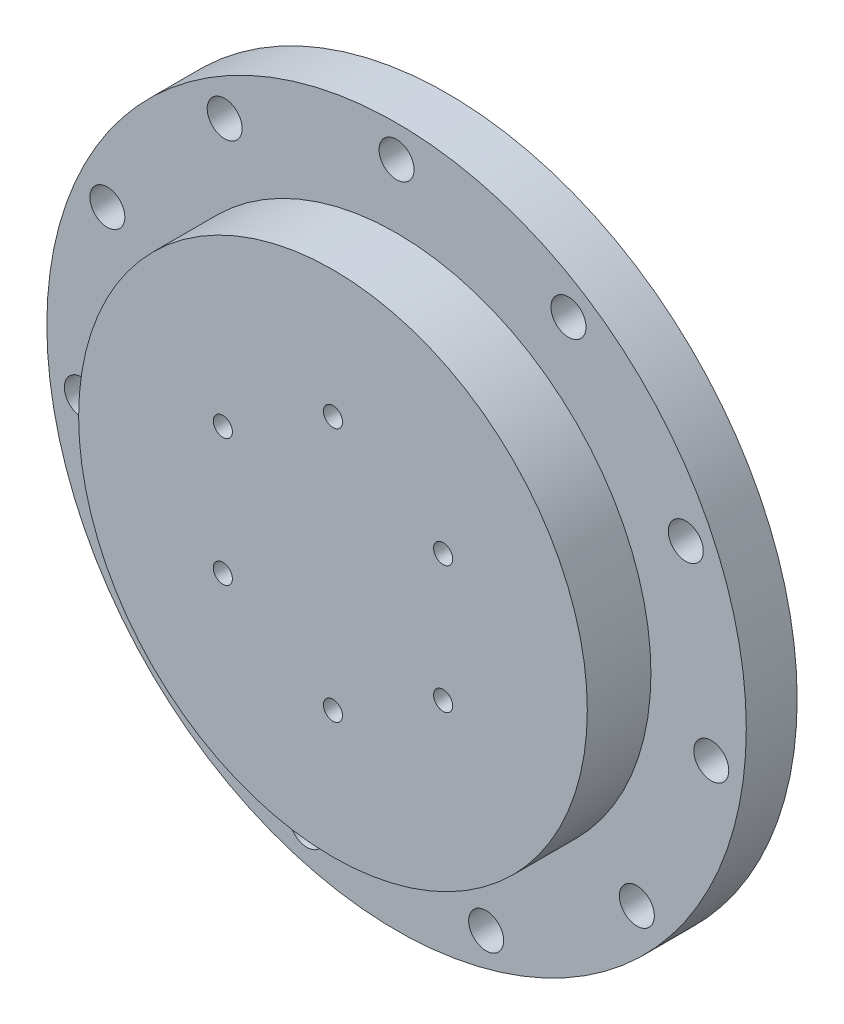
from build123d import *

# Parameters (mm, degrees)
SKETCH1_R           = 55
SKETCH1_R_2         = 1.5
BOSS_EXTRUDE1_DEPTH = 15
CUT_EXTRUDE2_START  = -10
SKETCH3_R           = 55
SKETCH3_R_2         = 17.5
CUT_EXTRUDE2_DEPTH  = 10
SKETCH7_R           = 12
CUT_EXTRUDE4_DEPTH  = 8
SKETCH8_R           = 37.5
BOSS_EXTRUDE2_DEPTH = 10
SKETCH9_R           = 12
CUT_EXTRUDE5_DEPTH  = 7
BOSS_EXTRUDE3_START = 3
SKETCH12_R          = 55
SKETCH12_R_2        = 12
SKETCH12_R_3        = 1.5
BOSS_EXTRUDE3_DEPTH = 3
SKETCH13_R          = 2.75
CUT_EXTRUDE7_DEPTH  = 4
SKETCH16_R          = 40
BOSS_EXTRUDE5_DEPTH = 10
SKETCH17_R          = 12
CUT_EXTRUDE8_DEPTH  = 2
SKETCH18_R          = 1.5
CUT_EXTRUDE9_DEPTH  = 5


with BuildPart() as part:
    # Sketch1 → Boss-Extrude1 (new body)
    with BuildSketch(Plane.XY):
        Circle(SKETCH1_R)
        with Locations((0, 50)):
            Circle(SKETCH1_R_2, mode=Mode.SUBTRACT)
        with Locations((27.032040873, 42.062676642)):
            Circle(SKETCH1_R_2, mode=Mode.SUBTRACT)
        with Locations((45.481599768, 20.77075065)):
            Circle(SKETCH1_R_2, mode=Mode.SUBTRACT)
        with Locations((49.491072094, -7.115741914)):
            Circle(SKETCH1_R_2, mode=Mode.SUBTRACT)
        with Locations((37.787478718, -32.743036697)):
            Circle(SKETCH1_R_2, mode=Mode.SUBTRACT)
        with Locations((14.086627842, -47.974648681)):
            Circle(SKETCH1_R_2, mode=Mode.SUBTRACT)
        with Locations((-14.086627842, -47.974648681)):
            Circle(SKETCH1_R_2, mode=Mode.SUBTRACT)
        with Locations((-37.787478718, -32.743036697)):
            Circle(SKETCH1_R_2, mode=Mode.SUBTRACT)
        with Locations((-49.491072094, -7.115741914)):
            Circle(SKETCH1_R_2, mode=Mode.SUBTRACT)
        with Locations((-45.481599768, 20.77075065)):
            Circle(SKETCH1_R_2, mode=Mode.SUBTRACT)
        with Locations((-27.032040873, 42.062676642)):
            Circle(SKETCH1_R_2, mode=Mode.SUBTRACT)
    extrude(amount=BOSS_EXTRUDE1_DEPTH)

    # Sketch3 → Cut-Extrude2 (cut)
    with BuildSketch(Plane.XY.offset(15).offset(CUT_EXTRUDE2_START)):
        Circle(SKETCH3_R)
        Circle(SKETCH3_R_2, mode=Mode.SUBTRACT)
    extrude(amount=CUT_EXTRUDE2_DEPTH, mode=Mode.SUBTRACT)

    # Sketch7 → Cut-Extrude4 (cut)
    with BuildSketch(Plane(origin=(0, 0, 0), x_dir=(-1, 0, 0), z_dir=(0, 0, -1))):
        Circle(SKETCH7_R)
    extrude(amount=-CUT_EXTRUDE4_DEPTH, mode=Mode.SUBTRACT)

    # Sketch8 → Boss-Extrude2 (add)
    with BuildSketch(Plane.XY.offset(5)):
        Circle(SKETCH8_R)
    extrude(amount=BOSS_EXTRUDE2_DEPTH)

    # Sketch9 → Cut-Extrude5 (cut)
    with BuildSketch(Plane(origin=(0, 0, 0), x_dir=(-1, 0, 0), z_dir=(0, 0, -1))):
        Circle(SKETCH9_R)
    extrude(amount=-CUT_EXTRUDE5_DEPTH, mode=Mode.SUBTRACT)

    # Sketch12 → Boss-Extrude3 (add)
    with BuildSketch(Plane(origin=(0, 0, 0), x_dir=(-1, 0, 0), z_dir=(0, 0, -1)).offset(BOSS_EXTRUDE3_START)):
        Circle(SKETCH12_R)
        Circle(SKETCH12_R_2, mode=Mode.SUBTRACT)
        with Locations((0, 50)):
            Circle(SKETCH12_R_3, mode=Mode.SUBTRACT)
        with Locations((27.032040873, 42.062676642)):
            Circle(SKETCH12_R_3, mode=Mode.SUBTRACT)
        with Locations((45.481599768, 20.77075065)):
            Circle(SKETCH12_R_3, mode=Mode.SUBTRACT)
        with Locations((49.491072094, -7.115741914)):
            Circle(SKETCH12_R_3, mode=Mode.SUBTRACT)
        with Locations((37.787478718, -32.743036697)):
            Circle(SKETCH12_R_3, mode=Mode.SUBTRACT)
        with Locations((14.086627842, -47.974648681)):
            Circle(SKETCH12_R_3, mode=Mode.SUBTRACT)
        with Locations((-14.086627842, -47.974648681)):
            Circle(SKETCH12_R_3, mode=Mode.SUBTRACT)
        with Locations((-37.787478718, -32.743036697)):
            Circle(SKETCH12_R_3, mode=Mode.SUBTRACT)
        with Locations((-49.491072094, -7.115741914)):
            Circle(SKETCH12_R_3, mode=Mode.SUBTRACT)
        with Locations((-45.481599768, 20.77075065)):
            Circle(SKETCH12_R_3, mode=Mode.SUBTRACT)
        with Locations((-27.032040873, 42.062676642)):
            Circle(SKETCH12_R_3, mode=Mode.SUBTRACT)
    extrude(amount=-BOSS_EXTRUDE3_DEPTH)

    # Sketch13 → Cut-Extrude7 (cut)
    with BuildSketch(Plane.XY.offset(5)):
        with Locations((0, 50)):
            Circle(SKETCH13_R)
        with Locations((27.032040873, 42.062676642)):
            Circle(SKETCH13_R)
        with Locations((45.481599768, 20.77075065)):
            Circle(SKETCH13_R)
        with Locations((49.491072094, -7.115741914)):
            Circle(SKETCH13_R)
        with Locations((37.787478718, -32.743036697)):
            Circle(SKETCH13_R)
        with Locations((14.086627842, -47.974648681)):
            Circle(SKETCH13_R)
        with Locations((-14.086627842, -47.974648681)):
            Circle(SKETCH13_R)
        with Locations((-37.787478718, -32.743036697)):
            Circle(SKETCH13_R)
        with Locations((-49.491072094, -7.115741914)):
            Circle(SKETCH13_R)
        with Locations((-45.481599768, 20.77075065)):
            Circle(SKETCH13_R)
        with Locations((-27.032040873, 42.062676642)):
            Circle(SKETCH13_R)
    extrude(amount=-CUT_EXTRUDE7_DEPTH, mode=Mode.SUBTRACT)

    # Sketch16 → Boss-Extrude5 (add)
    with BuildSketch(Plane.XY.offset(5)):
        Circle(SKETCH16_R)
    extrude(amount=BOSS_EXTRUDE5_DEPTH)

    # Sketch17 → Cut-Extrude8 (cut)
    with BuildSketch(Plane(origin=(0, 0, 5), x_dir=(-1, 0, 0), z_dir=(0, 0, -1))):
        Circle(SKETCH17_R)
    extrude(amount=-CUT_EXTRUDE8_DEPTH, mode=Mode.SUBTRACT)

    # Sketch18 → Cut-Extrude9 (cut)
    with BuildSketch(Plane.XY.offset(15)):
        with Locations((0, 20)):
            Circle(SKETCH18_R)
        with Locations((17.320508076, 10)):
            Circle(SKETCH18_R)
        with Locations((17.320508076, -10)):
            Circle(SKETCH18_R)
        with Locations((0, -20)):
            Circle(SKETCH18_R)
        with Locations((-17.320508076, -10)):
            Circle(SKETCH18_R)
        with Locations((-17.320508076, 10)):
            Circle(SKETCH18_R)
    extrude(amount=-CUT_EXTRUDE9_DEPTH, mode=Mode.SUBTRACT)


solid = part.part
